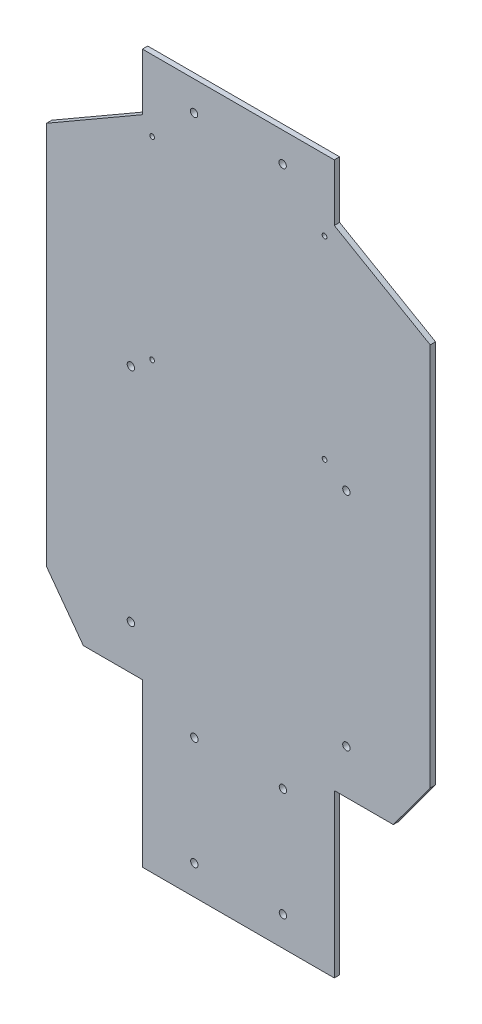
from build123d import *

# Parameters (mm, degrees)
BOSS_EXTRUDE1_DEPTH = 2.286
SKETCH18_R          = 1.5875
SKETCH18_R_2        = 1.016
CUT_EXTRUDE1_DEPTH  = 2.286


with BuildPart() as part:
    # Sketch1 → Boss-Extrude1 (new body)
    with BuildSketch(Plane.XY):
        Polygon((28.575, 108.380382361), (69.85, 84.55025), (69.85, -80.54975), (53.975, -102.122117639), (28.575, -102.122117639), (28.575, -171.972117639), (-53.975, -171.972117639), (-53.975, -102.122117639), (-79.375, -102.122117639), (-95.25, -80.54975), (-95.25, 84.55025), (-53.975, 108.380382361), (-53.975, 132.827882361), (28.575, 132.827882361), align=None)
    extrude(amount=BOSS_EXTRUDE1_DEPTH)

    # Sketch18 → Cut-Extrude1 (cut)
    with BuildSketch(Plane.XY.offset(2.286)):
        with Locations((-31.623, -159.272117639)):
            Circle(SKETCH18_R)
        with Locations((6.477, -159.272117639)):
            Circle(SKETCH18_R)
        with Locations((-31.75, 120.127882361)):
            Circle(SKETCH18_R)
        with Locations((6.35, 120.127882361)):
            Circle(SKETCH18_R)
        with Locations((-58.928, -83.072117639)):
            Circle(SKETCH18_R)
        with Locations((33.782, -83.072117639)):
            Circle(SKETCH18_R)
        with Locations((-58.928, 12.177882361)):
            Circle(SKETCH18_R)
        with Locations((33.782, 12.177882361)):
            Circle(SKETCH18_R)
        with Locations((-31.623, -112.536117639)):
            Circle(SKETCH18_R)
        with Locations((6.477, -112.536117639)):
            Circle(SKETCH18_R)
        with Locations((-49.784, 102.347882361)):
            Circle(SKETCH18_R_2)
        with Locations((24.384, 102.347882361)):
            Circle(SKETCH18_R_2)
        with Locations((-49.784, 19.162882361)):
            Circle(SKETCH18_R_2)
        with Locations((24.384, 19.162882361)):
            Circle(SKETCH18_R_2)
    extrude(amount=-CUT_EXTRUDE1_DEPTH, mode=Mode.SUBTRACT)


solid = part.part
